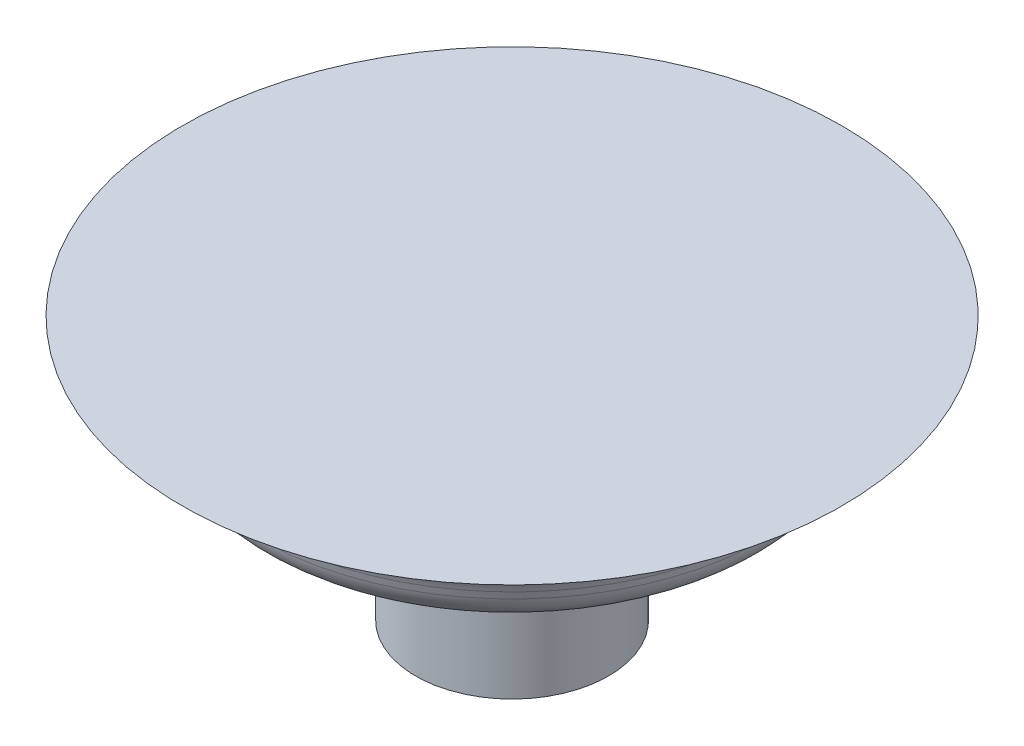
from build123d import *


with BuildPart() as part:
    # Эскиз1 → Повернуть1 (revolve)
    with BuildSketch(Plane.XY, mode=Mode.PRIVATE) as revolve_1_sk:
        with BuildLine():
            Line((0, 0), (0, -2.8))
            Line((0, -2.8), (1.025, -2.8))
            Line((1.025, -2.8), (1.025, -1))
            Line((1.025, -1), (2.314086796, -1))
            ThreePointArc((2.314086796, -1), (2.562042805, -0.913875481), (2.703223354, -0.692589088))
            Line((2.703223354, -0.692589088), (2.721726884, -0.614821824))
            ThreePointArc((2.721726884, -0.614821824), (3.004087982, -0.172249038), (3.5, 0))
            Line((3.5, 0), (0, 0))
        make_face()
    revolve(revolve_1_sk.sketch.rotate(Axis((0, 0, 0), (0, 1, 0)), 90), axis=Axis((0, 0, 0), (0, 1, 0)))


solid = part.part
